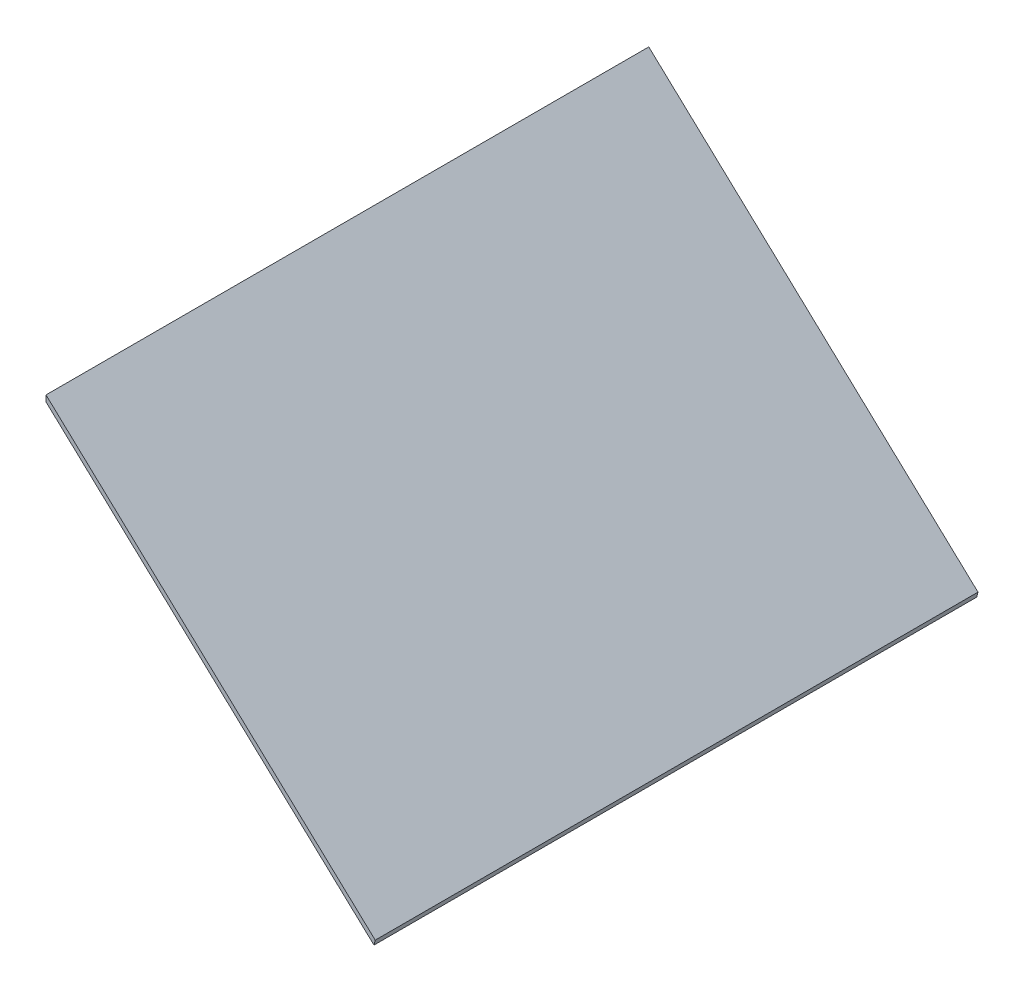
from build123d import *

# Parameters (mm, degrees)
BOSS_EXTRUDE1_DEPTH = 498.856


with BuildPart() as part:
    # Sketch1 → Boss-Extrude1 (new body)
    with BuildSketch(Plane.XY):
        Polygon((271.455287553, 0), (0, 253.580449429), (0, 258.628350399), (272.483044068, 4.087820356), align=None)
    extrude(amount=BOSS_EXTRUDE1_DEPTH)


solid = part.part
